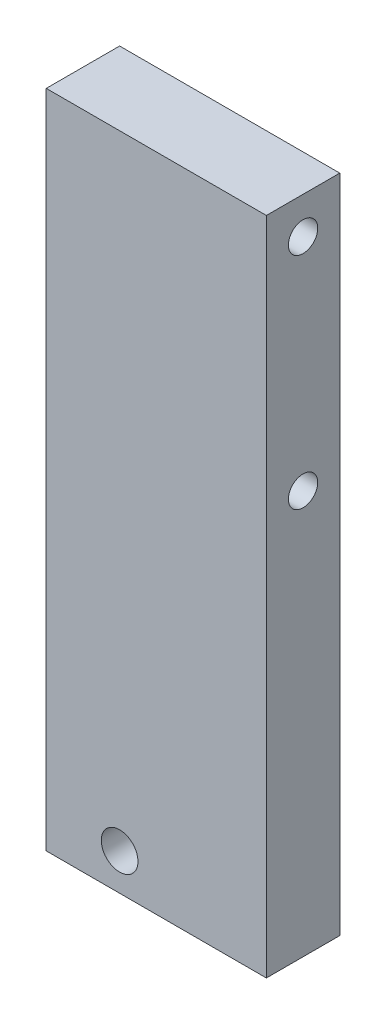
from build123d import *

# Parameters (mm, degrees)
SKETCH1_W           = 30
SKETCH1_H           = 90
BOSS_EXTRUDE1_DEPTH = 10
CUT_EXTRUDE2_REACH  = 97.394
SKETCH4_R           = 2.5
SKETCH3_R           = 2
CUT_EXTRUDE3_DEPTH  = 96.393920142


with BuildPart() as part:
    # Sketch1 → Boss-Extrude1 (new body)
    with BuildSketch(Plane.XY):
        with Locations((15, 45)):
            Rectangle(SKETCH1_W, SKETCH1_H)
    extrude(amount=BOSS_EXTRUDE1_DEPTH)

    # Sketch4 → Cut-Extrude2 (cut, up to next)
    with BuildSketch(Plane.XY.offset(10), mode=Mode.PRIVATE) as cut_extrude2_sk1:
        with Locations((10, 5)):
            Circle(SKETCH4_R)
    cut_extrude2_tool1 = extrude(cut_extrude2_sk1.sketch, amount=-CUT_EXTRUDE2_REACH, mode=Mode.PRIVATE) & part.part
    add(cut_extrude2_tool1.solids().sort_by_distance((10, 5, 10))[0], mode=Mode.SUBTRACT)

    # Sketch3 → Cut-Extrude3 (cut, through all)
    with BuildSketch(Plane(origin=(30, 0, 0), x_dir=(0, 0, -1), z_dir=(1, 0, 0))):
        with Locations((-5, 85)):
            Circle(SKETCH3_R)
        with Locations((-5, 55)):
            Circle(SKETCH3_R)
    extrude(amount=-CUT_EXTRUDE3_DEPTH, mode=Mode.SUBTRACT)


solid = part.part
